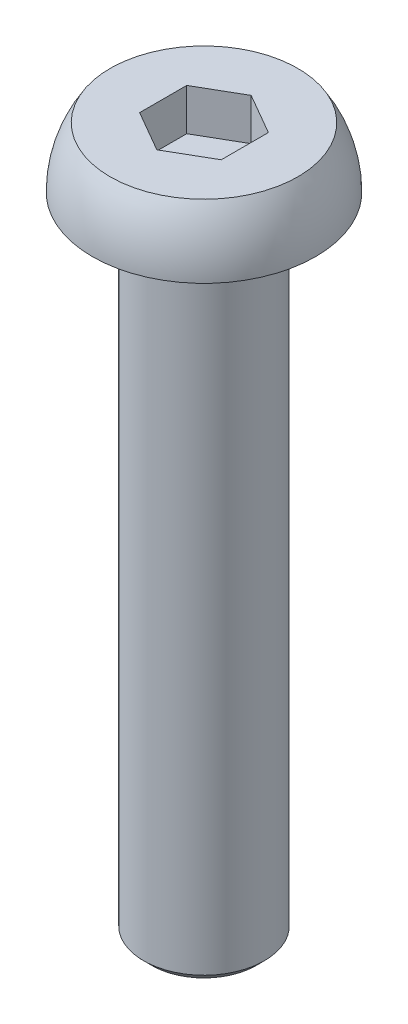
from build123d import *

# Parameters (mm, degrees)
SKETCH_2_R          = 1.5
EXTRUDE_1_DEPTH     = 16
CUT_EXTRUDE_1_DEPTH = 1.04
CHAMFER_1_SIZE      = 0.2


with BuildPart() as part:
    # 草图1 → 旋转1 (revolve)
    with BuildSketch(Plane.XY, mode=Mode.PRIVATE) as revolve_1_sk:
        with BuildLine():
            Line((0, 0), (-2.775, 0))
            ThreePointArc((-2.775, 0), (-2.662639591, 0.78164916), (-2.334657362, 1.5))
            Line((-2.334657362, 1.5), (0, 1.5))
            Line((0, 1.5), (0, 0))
        make_face()
    revolve(revolve_1_sk.sketch.rotate(Axis((0, 5.111773046, 0), (0, -1, 0)), 270), axis=Axis((0, 5.111773046, 0), (0, -1, 0)))

    # 草图2 → 凸台-拉伸1 (add)
    with BuildSketch(Plane.XZ):
        with Locations(Location((0, 0, 0), (0, 0, 270))):
            Circle(SKETCH_2_R)
    extrude(amount=EXTRUDE_1_DEPTH)

    # 草图3 → 切除-拉伸1 (cut)
    with BuildSketch(Plane(origin=(0, 1.5, 0), x_dir=(1, 0, 0), z_dir=(0, 1, 0))):
        Polygon((0, 1.172021046), (-1.015, 0.586010523), (-1.015, -0.586010523), (0, -1.172021046), (1.015, -0.586010523), (1.015, 0.586010523), align=None)
    extrude(amount=-CUT_EXTRUDE_1_DEPTH, mode=Mode.SUBTRACT)

    # 倒角1
    chamfer_1_edges = [part.edges().sort_by_distance(p)[0] for p in [
        (0, -16, 1.5),
    ]]
    chamfer(chamfer_1_edges, length=CHAMFER_1_SIZE)


solid = part.part
